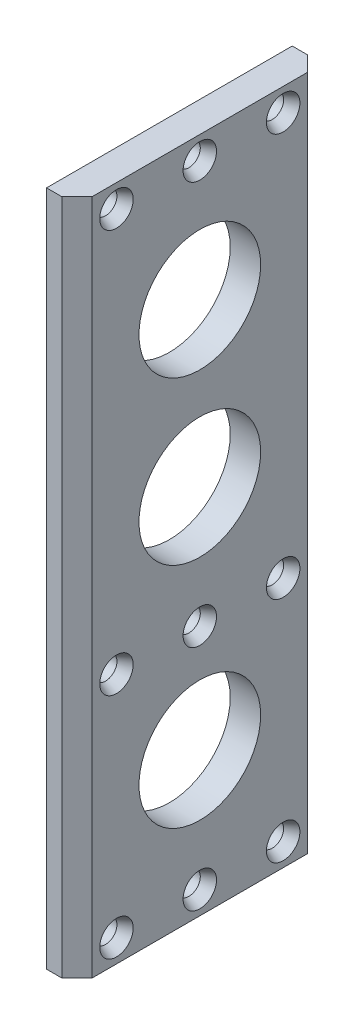
from build123d import *

# Parameters (mm, degrees)
SKETCH1_W                    = 32.31333688
SKETCH1_H                    = 89
EXTRUDE1_DEPTH               = 4
SKETCH2_R                    = 1.5
SKETCH2_R_2                  = 8
CUT_EXTRUDE1_DEPTH           = 4
CHAMFER1_SIZE                = 2
SKETCH4_R                    = 2.2
CUT_EXTRUDE2_DEPTH           = 1.5
CUT_EXTRUDE2_DRAFT           = -26
CUT_EXTRUDE2_PROFILE_2_DEPTH = 1.5
CUT_EXTRUDE2_PROFILE_2_DRAFT = -26
CUT_EXTRUDE2_PROFILE_3_DEPTH = 1.5
CUT_EXTRUDE2_PROFILE_3_DRAFT = -26
CUT_EXTRUDE2_PROFILE_4_DEPTH = 1.5
CUT_EXTRUDE2_PROFILE_4_DRAFT = -26
CUT_EXTRUDE2_PROFILE_5_DEPTH = 1.5
CUT_EXTRUDE2_PROFILE_5_DRAFT = -26
CUT_EXTRUDE2_PROFILE_6_DEPTH = 1.5
CUT_EXTRUDE2_PROFILE_6_DRAFT = -26
CUT_EXTRUDE2_PROFILE_7_DEPTH = 1.5
CUT_EXTRUDE2_PROFILE_7_DRAFT = -26
CUT_EXTRUDE2_PROFILE_8_DEPTH = 1.5
CUT_EXTRUDE2_PROFILE_8_DRAFT = -26
CUT_EXTRUDE2_PROFILE_9_DEPTH = 1.5
CUT_EXTRUDE2_PROFILE_9_DRAFT = -26


with BuildPart() as part:
    # Sketch1 → Extrude1 (new body)
    with BuildSketch(Plane(origin=(0, 0, 0), x_dir=(0, 0, -1), z_dir=(1, 0, 0))):
        with Locations((16.181856, -44.5)):
            Rectangle(SKETCH1_W, SKETCH1_H)
    extrude(amount=EXTRUDE1_DEPTH)

    # Sketch2 → Cut-Extrude1 (cut)
    with BuildSketch(Plane(origin=(4, 0, 0), x_dir=(0, 0, -1), z_dir=(1, 0, 0))):
        with Locations((5.219637339, -3)):
            Circle(SKETCH2_R)
        with Locations(Location((27.14407466, -3, 0), (0, 0, 180))):
            Circle(SKETCH2_R)
        with Locations((16.181856, -3)):
            Circle(SKETCH2_R)
        with Locations((27.14407466, -86)):
            Circle(SKETCH2_R)
        with Locations(Location((16.181856, -86, 0), (0, 0, 180))):
            Circle(SKETCH2_R)
        with Locations(Location((5.219637339, -86, 0), (0, 0, 180))):
            Circle(SKETCH2_R)
        with Locations((5.219637339, -56)):
            Circle(SKETCH2_R)
        with Locations((16.181856, -56)):
            Circle(SKETCH2_R)
        with Locations((27.14407466, -56)):
            Circle(SKETCH2_R)
        with Locations((16.181856, -18.814665041)):
            Circle(SKETCH2_R_2)
        with Locations((16.181856, -40.149876352)):
            Circle(SKETCH2_R_2)
        with Locations((16.181856, -70.116890711)):
            Circle(SKETCH2_R_2)
    extrude(amount=-CUT_EXTRUDE1_DEPTH, mode=Mode.SUBTRACT)

    # Chamfer1
    chamfer1_edges = [part.edges().sort_by_distance(p)[0] for p in [
        (4, -44.5, -32.33852444),
        (4, -44.5, -0.02518756),
    ]]
    chamfer(chamfer1_edges, length=CHAMFER1_SIZE)


with BuildPart() as cut_extrude2_tool:
    # Sketch4 → Cut-Extrude2 (with draft: the straight prism first)
    with BuildSketch(Plane(origin=(4, 0, 0), x_dir=(0, 0, -1), z_dir=(1, 0, 0))):
        with Locations((5.219637339, -3)):
            Circle(SKETCH4_R)
    extrude(amount=-CUT_EXTRUDE2_DEPTH)
    # Cut-Extrude2: the draft: its side faces are tilted about the plane it starts from
    cut_extrude2_sides = [cut_extrude2_tool.faces().sort_by_distance(p)[0] for p in [
        (3.25, -3, -3.019637339),
    ]]
    draft(cut_extrude2_sides, Plane(origin=(4, 0, 0), x_dir=(0, 0, -1), z_dir=(1, 0, 0)), CUT_EXTRUDE2_DRAFT)


with BuildPart() as part_1:
    add(part.part)

    # Cut-Extrude2: cut by cut_extrude2_tool
    add(cut_extrude2_tool.part, mode=Mode.SUBTRACT)


with BuildPart() as cut_extrude2_profile_2_tool:
    # Sketch4 → Cut-Extrude2 profile 2 (with draft: the straight prism first)
    with BuildSketch(Plane(origin=(4, 0, 0), x_dir=(0, 0, -1), z_dir=(1, 0, 0))):
        with Locations((16.181856, -3)):
            Circle(SKETCH4_R)
    extrude(amount=-CUT_EXTRUDE2_PROFILE_2_DEPTH)
    # Cut-Extrude2 profile 2: the draft: its side faces are tilted about the plane it starts from
    cut_extrude2_profile_2_sides = [cut_extrude2_profile_2_tool.faces().sort_by_distance(p)[0] for p in [
        (3.25, -3, -13.981856),
    ]]
    draft(cut_extrude2_profile_2_sides, Plane(origin=(4, 0, 0), x_dir=(0, 0, -1), z_dir=(1, 0, 0)), CUT_EXTRUDE2_PROFILE_2_DRAFT)


with BuildPart() as part_2:
    add(part_1.part)

    # Cut-Extrude2 profile 2: cut by cut_extrude2_profile_2_tool
    add(cut_extrude2_profile_2_tool.part, mode=Mode.SUBTRACT)


with BuildPart() as cut_extrude2_profile_3_tool:
    # Sketch4 → Cut-Extrude2 profile 3 (with draft: the straight prism first)
    with BuildSketch(Plane(origin=(4, 0, 0), x_dir=(0, 0, -1), z_dir=(1, 0, 0))):
        with Locations((27.14407466, -3)):
            Circle(SKETCH4_R)
    extrude(amount=-CUT_EXTRUDE2_PROFILE_3_DEPTH)
    # Cut-Extrude2 profile 3: the draft: its side faces are tilted about the plane it starts from
    cut_extrude2_profile_3_sides = [cut_extrude2_profile_3_tool.faces().sort_by_distance(p)[0] for p in [
        (3.25, -3, -24.94407466),
    ]]
    draft(cut_extrude2_profile_3_sides, Plane(origin=(4, 0, 0), x_dir=(0, 0, -1), z_dir=(1, 0, 0)), CUT_EXTRUDE2_PROFILE_3_DRAFT)


with BuildPart() as part_3:
    add(part_2.part)

    # Cut-Extrude2 profile 3: cut by cut_extrude2_profile_3_tool
    add(cut_extrude2_profile_3_tool.part, mode=Mode.SUBTRACT)


with BuildPart() as cut_extrude2_profile_4_tool:
    # Sketch4 → Cut-Extrude2 profile 4 (with draft: the straight prism first)
    with BuildSketch(Plane(origin=(4, 0, 0), x_dir=(0, 0, -1), z_dir=(1, 0, 0))):
        with Locations((5.219637339, -56)):
            Circle(SKETCH4_R)
    extrude(amount=-CUT_EXTRUDE2_PROFILE_4_DEPTH)
    # Cut-Extrude2 profile 4: the draft: its side faces are tilted about the plane it starts from
    cut_extrude2_profile_4_sides = [cut_extrude2_profile_4_tool.faces().sort_by_distance(p)[0] for p in [
        (3.25, -56, -3.019637339),
    ]]
    draft(cut_extrude2_profile_4_sides, Plane(origin=(4, 0, 0), x_dir=(0, 0, -1), z_dir=(1, 0, 0)), CUT_EXTRUDE2_PROFILE_4_DRAFT)


with BuildPart() as part_4:
    add(part_3.part)

    # Cut-Extrude2 profile 4: cut by cut_extrude2_profile_4_tool
    add(cut_extrude2_profile_4_tool.part, mode=Mode.SUBTRACT)


with BuildPart() as cut_extrude2_profile_5_tool:
    # Sketch4 → Cut-Extrude2 profile 5 (with draft: the straight prism first)
    with BuildSketch(Plane(origin=(4, 0, 0), x_dir=(0, 0, -1), z_dir=(1, 0, 0))):
        with Locations((16.181856, -56)):
            Circle(SKETCH4_R)
    extrude(amount=-CUT_EXTRUDE2_PROFILE_5_DEPTH)
    # Cut-Extrude2 profile 5: the draft: its side faces are tilted about the plane it starts from
    cut_extrude2_profile_5_sides = [cut_extrude2_profile_5_tool.faces().sort_by_distance(p)[0] for p in [
        (3.25, -56, -13.981856),
    ]]
    draft(cut_extrude2_profile_5_sides, Plane(origin=(4, 0, 0), x_dir=(0, 0, -1), z_dir=(1, 0, 0)), CUT_EXTRUDE2_PROFILE_5_DRAFT)


with BuildPart() as part_5:
    add(part_4.part)

    # Cut-Extrude2 profile 5: cut by cut_extrude2_profile_5_tool
    add(cut_extrude2_profile_5_tool.part, mode=Mode.SUBTRACT)


with BuildPart() as cut_extrude2_profile_6_tool:
    # Sketch4 → Cut-Extrude2 profile 6 (with draft: the straight prism first)
    with BuildSketch(Plane(origin=(4, 0, 0), x_dir=(0, 0, -1), z_dir=(1, 0, 0))):
        with Locations((27.14407466, -56)):
            Circle(SKETCH4_R)
    extrude(amount=-CUT_EXTRUDE2_PROFILE_6_DEPTH)
    # Cut-Extrude2 profile 6: the draft: its side faces are tilted about the plane it starts from
    cut_extrude2_profile_6_sides = [cut_extrude2_profile_6_tool.faces().sort_by_distance(p)[0] for p in [
        (3.25, -56, -24.94407466),
    ]]
    draft(cut_extrude2_profile_6_sides, Plane(origin=(4, 0, 0), x_dir=(0, 0, -1), z_dir=(1, 0, 0)), CUT_EXTRUDE2_PROFILE_6_DRAFT)


with BuildPart() as part_6:
    add(part_5.part)

    # Cut-Extrude2 profile 6: cut by cut_extrude2_profile_6_tool
    add(cut_extrude2_profile_6_tool.part, mode=Mode.SUBTRACT)


with BuildPart() as cut_extrude2_profile_7_tool:
    # Sketch4 → Cut-Extrude2 profile 7 (with draft: the straight prism first)
    with BuildSketch(Plane(origin=(4, 0, 0), x_dir=(0, 0, -1), z_dir=(1, 0, 0))):
        with Locations((5.219637339, -86)):
            Circle(SKETCH4_R)
    extrude(amount=-CUT_EXTRUDE2_PROFILE_7_DEPTH)
    # Cut-Extrude2 profile 7: the draft: its side faces are tilted about the plane it starts from
    cut_extrude2_profile_7_sides = [cut_extrude2_profile_7_tool.faces().sort_by_distance(p)[0] for p in [
        (3.25, -86, -3.019637339),
    ]]
    draft(cut_extrude2_profile_7_sides, Plane(origin=(4, 0, 0), x_dir=(0, 0, -1), z_dir=(1, 0, 0)), CUT_EXTRUDE2_PROFILE_7_DRAFT)


with BuildPart() as part_7:
    add(part_6.part)

    # Cut-Extrude2 profile 7: cut by cut_extrude2_profile_7_tool
    add(cut_extrude2_profile_7_tool.part, mode=Mode.SUBTRACT)


with BuildPart() as cut_extrude2_profile_8_tool:
    # Sketch4 → Cut-Extrude2 profile 8 (with draft: the straight prism first)
    with BuildSketch(Plane(origin=(4, 0, 0), x_dir=(0, 0, -1), z_dir=(1, 0, 0))):
        with Locations((16.181856, -86)):
            Circle(SKETCH4_R)
    extrude(amount=-CUT_EXTRUDE2_PROFILE_8_DEPTH)
    # Cut-Extrude2 profile 8: the draft: its side faces are tilted about the plane it starts from
    cut_extrude2_profile_8_sides = [cut_extrude2_profile_8_tool.faces().sort_by_distance(p)[0] for p in [
        (3.25, -86, -13.981856),
    ]]
    draft(cut_extrude2_profile_8_sides, Plane(origin=(4, 0, 0), x_dir=(0, 0, -1), z_dir=(1, 0, 0)), CUT_EXTRUDE2_PROFILE_8_DRAFT)


with BuildPart() as part_8:
    add(part_7.part)

    # Cut-Extrude2 profile 8: cut by cut_extrude2_profile_8_tool
    add(cut_extrude2_profile_8_tool.part, mode=Mode.SUBTRACT)


with BuildPart() as cut_extrude2_profile_9_tool:
    # Sketch4 → Cut-Extrude2 profile 9 (with draft: the straight prism first)
    with BuildSketch(Plane(origin=(4, 0, 0), x_dir=(0, 0, -1), z_dir=(1, 0, 0))):
        with Locations((27.14407466, -86)):
            Circle(SKETCH4_R)
    extrude(amount=-CUT_EXTRUDE2_PROFILE_9_DEPTH)
    # Cut-Extrude2 profile 9: the draft: its side faces are tilted about the plane it starts from
    cut_extrude2_profile_9_sides = [cut_extrude2_profile_9_tool.faces().sort_by_distance(p)[0] for p in [
        (3.25, -86, -24.94407466),
    ]]
    draft(cut_extrude2_profile_9_sides, Plane(origin=(4, 0, 0), x_dir=(0, 0, -1), z_dir=(1, 0, 0)), CUT_EXTRUDE2_PROFILE_9_DRAFT)


with BuildPart() as part_9:
    add(part_8.part)

    # Cut-Extrude2 profile 9: cut by cut_extrude2_profile_9_tool
    add(cut_extrude2_profile_9_tool.part, mode=Mode.SUBTRACT)


solid = part_9.part
